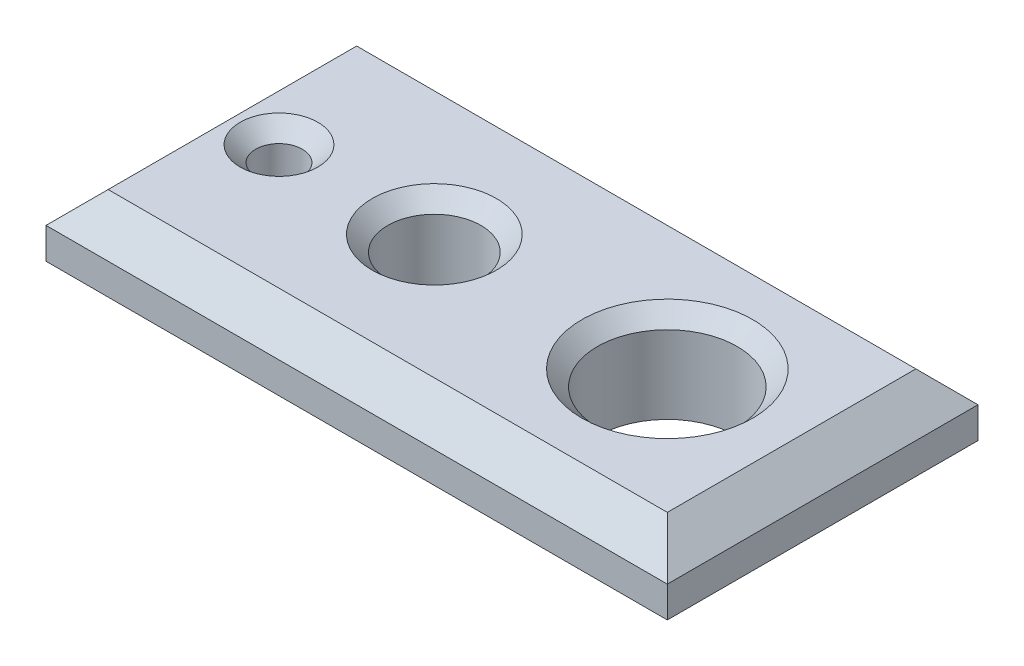
from build123d import *

# Parameters (mm, degrees)
SKETCH1_W           = 200
SKETCH1_H           = 100
BOSS_EXTRUDE1_DEPTH = 30
CHAMFER1_SIZE       = 10
SKETCH2_R           = 7.5
SKETCH2_R_2         = 15
SKETCH2_R_3         = 22.5
CUT_EXTRUDE1_DEPTH  = 116.758369028
CHAMFER3_SIZE       = 5


with BuildPart() as part:
    # Sketch1 → Boss-Extrude1 (new body)
    with BuildSketch(Plane(origin=(0, 0, 0), x_dir=(1, 0, 0), z_dir=(0, 1, 0))):
        Rectangle(SKETCH1_W, SKETCH1_H)
    extrude(amount=BOSS_EXTRUDE1_DEPTH)

    # Chamfer1
    chamfer1_edges = [part.edges().sort_by_distance(p)[0] for p in [
        (-100, 30, 0),
        (0, 30, 50),
        (100, 30, 0),
        (0, 0, 50),
        (-100, 0, 0),
        (0, 0, -50),
        (100, 0, 0),
        (0, 30, -50),
    ]]
    chamfer(chamfer1_edges, length=CHAMFER1_SIZE)

    # Sketch2 → Cut-Extrude1 (cut, through all)
    with BuildSketch(Plane(origin=(0, 30, 0), x_dir=(1, 0, 0), z_dir=(0, 1, 0))):
        with Locations(Location((-75, 0, 0), (0, 0, 270))):
            Circle(SKETCH2_R)
        with Locations(Location((-25, 0, 0), (0, 0, 270))):
            Circle(SKETCH2_R_2)
        with Locations(Location((50, 0, 0), (0, 0, 270))):
            Circle(SKETCH2_R_3)
    extrude(amount=-CUT_EXTRUDE1_DEPTH, mode=Mode.SUBTRACT)

    # Chamfer3
    chamfer3_edges = [part.edges().sort_by_distance(p)[0] for p in [
        (-75, 30, -7.5),
        (-25, 30, -15),
        (50, 30, -22.5),
    ]]
    chamfer(chamfer3_edges, length=CHAMFER3_SIZE)


solid = part.part
